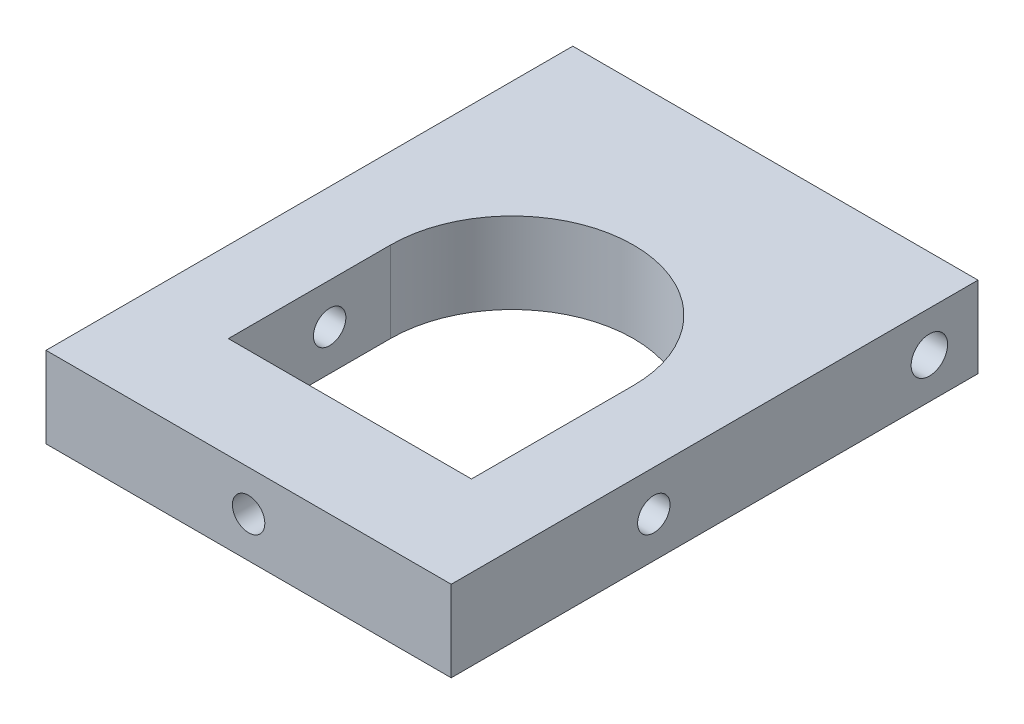
from build123d import *

# Parameters (mm, degrees)
SKETCH1_W               = 50
SKETCH1_H               = 65
BOSS_EXTRUDE1_DEPTH     = 10
CUT_EXTRUDE1_DEPTH      = 43.20485754
CUT_EXTRUDE1_DEPTH_BACK = 43.20485754
SKETCH6_R               = 2
SKETCH6_R_2             = 2.25
SKETCH7_R               = 2
CUT_EXTRUDE2_DEPTH      = 43.20485754
SKETCH8_W               = 2.7
SKETCH8_H               = 7.5
SKETCH8_W_2             = 7.5
SKETCH8_H_2             = 2.7
CUT_EXTRUDE3_DEPTH      = 8.75


with BuildPart() as part:
    # Sketch1 → Boss-Extrude1 (new body)
    with BuildSketch(Plane(origin=(0, 0, 0), x_dir=(1, 0, 0), z_dir=(0, 1, 0))):
        Rectangle(SKETCH1_W, SKETCH1_H)
        with BuildLine():
            Line((-15, 0), (-15, -20))
            Line((-15, -20), (15, -20))
            Line((15, -20), (15, 0))
            ThreePointArc((15, 0), (0, 15), (-15, 0))
        make_face(mode=Mode.SUBTRACT)
    extrude(amount=BOSS_EXTRUDE1_DEPTH)

    # Sketch6 → Cut-Extrude1 (cut, two sides: drawn at the far end of the back side and taken through both)
    with BuildSketch(Plane(origin=(0, 0, 0), x_dir=(0, 0, -1), z_dir=(1, 0, 0)).offset(-CUT_EXTRUDE1_DEPTH_BACK)):
        with Locations((-7.5, 5)):
            Circle(SKETCH6_R)
        with Locations((26.5, 5)):
            Circle(SKETCH6_R_2)
    extrude(amount=CUT_EXTRUDE1_DEPTH + CUT_EXTRUDE1_DEPTH_BACK, mode=Mode.SUBTRACT)

    # Sketch7 → Cut-Extrude2 (cut, through all)
    with BuildSketch(Plane.XY):
        with Locations(Location((0, 5, 0), (0, 0, 180))):
            Circle(SKETCH7_R)
    extrude(amount=CUT_EXTRUDE2_DEPTH, mode=Mode.SUBTRACT)

    # Sketch8 → Cut-Extrude3 (cut)
    with BuildSketch(Plane(origin=(0, 0, 0), x_dir=(1, 0, 0), z_dir=(0, 1, 0))):
        with Locations((20, -7.5)):
            Rectangle(SKETCH8_W, SKETCH8_H)
        with Locations((-20, -7.5)):
            Rectangle(SKETCH8_W, SKETCH8_H)
        with Locations((0, -26.25)):
            Rectangle(SKETCH8_W_2, SKETCH8_H_2)
    extrude(amount=CUT_EXTRUDE3_DEPTH, mode=Mode.SUBTRACT)


solid = part.part
